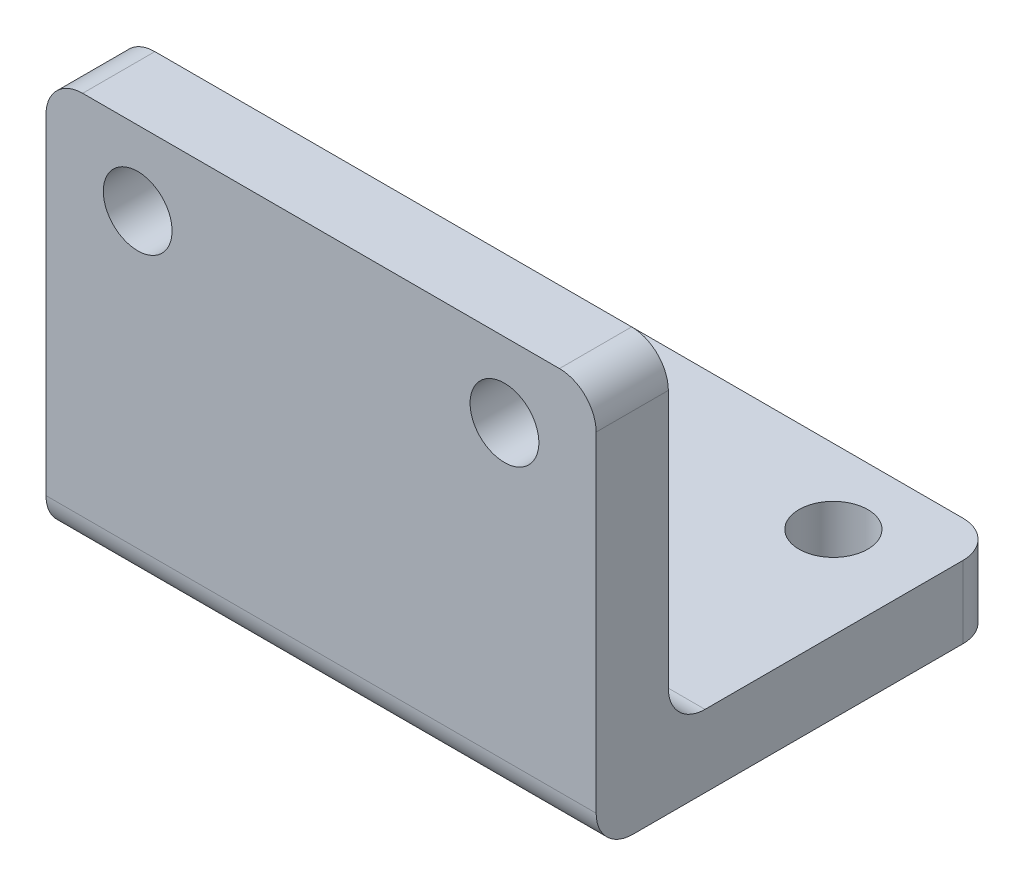
from build123d import *

# Parameters (mm, degrees)
BOSS_EXTRUDE1_DEPTH            = 38.1
FILLET1_R                      = 2.54
SKETCH3_R                      = 2.38125
GUESS_OF_WHERE_HOLES_ARE_DEPTH = 53.521397544
SKETCH4_R                      = 2.38125
CUT_EXTRUDE2_DEPTH             = 53.521397544


with BuildPart() as part:
    # Sketch2 → Boss-Extrude1 (new body)
    with BuildSketch(Plane(origin=(0, 0, 0), x_dir=(0, 0, -1), z_dir=(1, 0, 0))):
        Polygon((0, 0), (27.94, 0), (27.94, 5), (5, 5), (5, 27.94), (0, 27.94), align=None)
    extrude(amount=BOSS_EXTRUDE1_DEPTH)

    # Fillet1
    fillet1_edges = [part.edges().sort_by_distance(p)[0] for p in [
        (19.05, 5, -5),
        (19.05, 0, 0),
        (38.1, 2.5, -27.94),
        (0, 2.5, -27.94),
        (0, 27.94, -2.5),
        (38.1, 27.94, -2.5),
    ]]
    fillet(fillet1_edges, radius=FILLET1_R)

    # Sketch3 → guess_of_where_holes_are (cut, through all)
    with BuildSketch(Plane(origin=(0, 0, -5), x_dir=(-1, 0, 0), z_dir=(0, 0, -1))):
        with Locations((-31.75, 22.78)):
            Circle(SKETCH3_R)
        with Locations((-6.35, 22.78)):
            Circle(SKETCH3_R)
    extrude(amount=-GUESS_OF_WHERE_HOLES_ARE_DEPTH, mode=Mode.SUBTRACT)

    # Sketch4 → Cut-Extrude2 (cut, through all)
    with BuildSketch(Plane(origin=(0, 5, 0), x_dir=(1, 0, 0), z_dir=(0, 1, 0))):
        with Locations(Location((31.75, 22.78, 0), (0, 0, 270))):
            Circle(SKETCH4_R)
        with Locations(Location((6.35, 22.78, 0), (0, 0, 270))):
            Circle(SKETCH4_R)
    extrude(amount=-CUT_EXTRUDE2_DEPTH, mode=Mode.SUBTRACT)


solid = part.part
